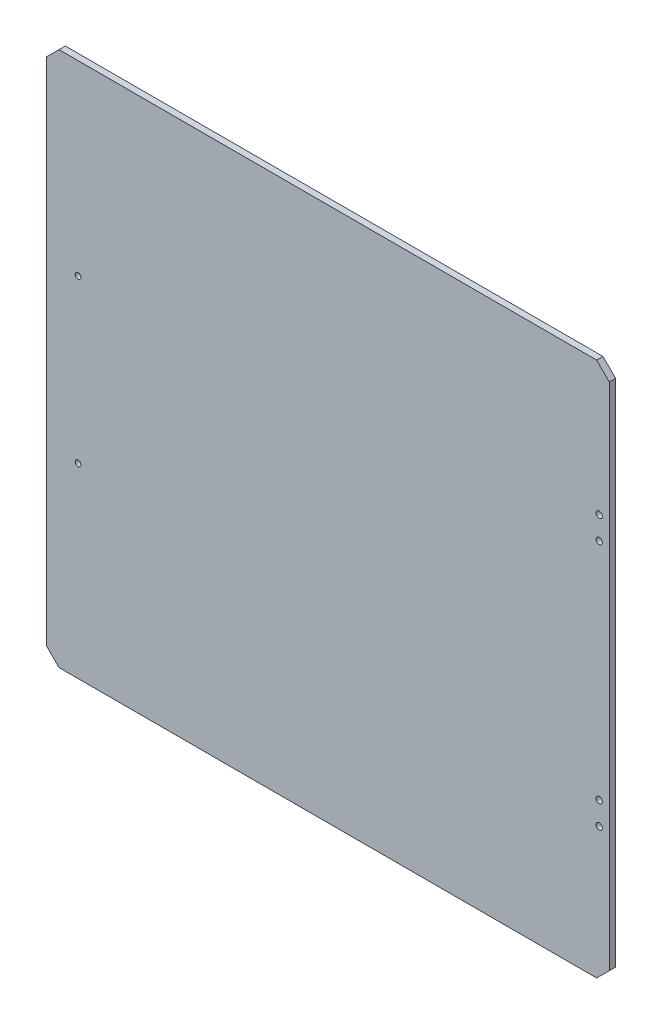
from build123d import *

# Parameters (mm, degrees)
SCHIZZO1_R                   = 2.5
SCHIZZO1_R_2                 = 2.25
ESTRUSIONE_ESTRUSIONE1_DEPTH = 5


with BuildPart() as part:
    # Schizzo1 → Estrusione-Estrusione1 (new body)
    with BuildSketch(Plane.XY):
        Polygon((-222, 201), (-212, 211), (212, 211), (222, 201), (222, -201), (212, -211), (-212, -211), (-222, -201), align=None)
        with Locations((214, 106.440434068)):
            Circle(SCHIZZO1_R, mode=Mode.SUBTRACT)
        with Locations((214, 88.440434068)):
            Circle(SCHIZZO1_R, mode=Mode.SUBTRACT)
        with Locations(Location((214, -88.440434068, 0), (0, 0, 180))):
            Circle(SCHIZZO1_R, mode=Mode.SUBTRACT)
        with Locations(Location((214, -106.440434068, 0), (0, 0, 180))):
            Circle(SCHIZZO1_R, mode=Mode.SUBTRACT)
        with Locations((-197, 64)):
            Circle(SCHIZZO1_R_2, mode=Mode.SUBTRACT)
        with Locations(Location((-197, -64, 0), (0, 0, 180))):
            Circle(SCHIZZO1_R_2, mode=Mode.SUBTRACT)
    extrude(amount=ESTRUSIONE_ESTRUSIONE1_DEPTH)


solid = part.part
